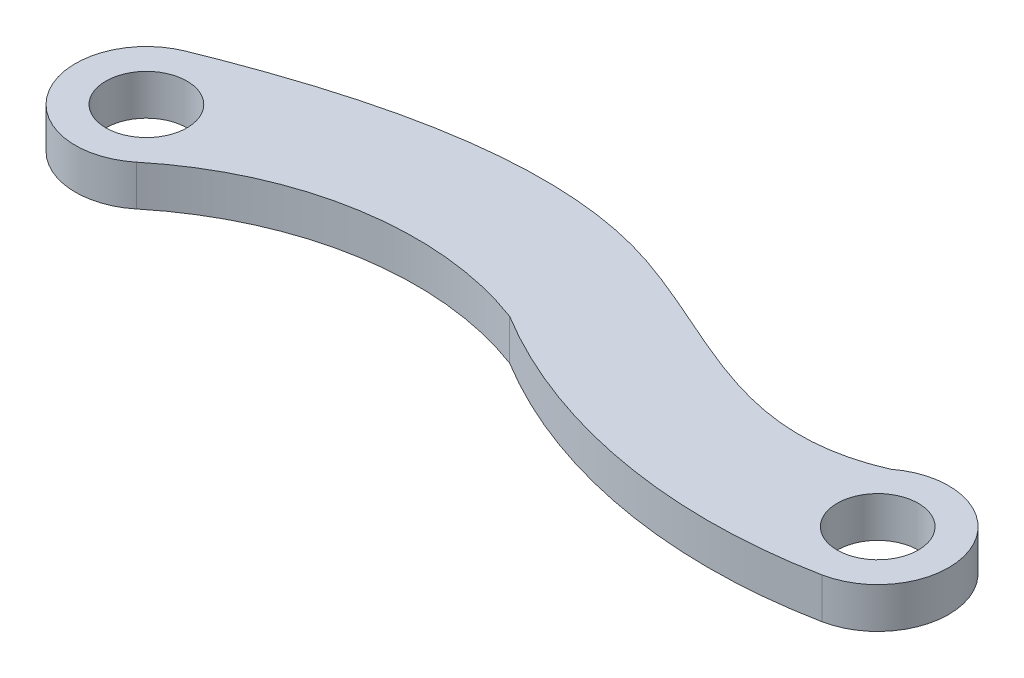
from build123d import *

# Parameters (mm, degrees)
SKETCH2_R           = 2.000000006
BOSS_EXTRUDE1_DEPTH = 2


with BuildPart() as part:
    # Sketch2 → Boss-Extrude1 (new body)
    with BuildSketch(Plane(origin=(0, 0, 0), x_dir=(1, 0, 0), z_dir=(0, 1, 0))):
        with BuildLine():
            ThreePointArc((-27.926975425, 9.714102761), (-29.649166118, 4.682637411), (-24.412176183, 3.757693749))
            ThreePointArc((-24.412176183, 3.757693749), (-16.874008703, 7.178664325), (-8.63567196, 6.368222256))
            ThreePointArc((-8.63567196, 6.368222256), (0.414236301, 2.94154028), (10.090788082, 3.027182087))
            ThreePointArc((10.090788082, 3.027182087), (12.602603797, 7.907109409), (7.276457736, 9.231902599))
            add(Edge.make_bspline(
                [(7.276457736, 9.231902599), (4.991666248, 8.239417516), (-0.384919766, 8.392254408), (-11.300329238, 15.23385505), (-22.195691788, 12.013740113), (-27.926975425, 9.714102761)],
                knots=[0.02947385, 0.02947385, 0.02947385, 0.02947385, 0.205279709, 0.474213823, 1, 1, 1, 1], degree=3))
        make_face()
        with Locations(Location((-26.634838433, 6.461352848, 0), (0, 0, 270))):
            Circle(SKETCH2_R, mode=Mode.SUBTRACT)
        with Locations(Location((9.415161567, 6.461352848, 0), (0, 0, 270))):
            Circle(SKETCH2_R, mode=Mode.SUBTRACT)
    extrude(amount=BOSS_EXTRUDE1_DEPTH)


solid = part.part
